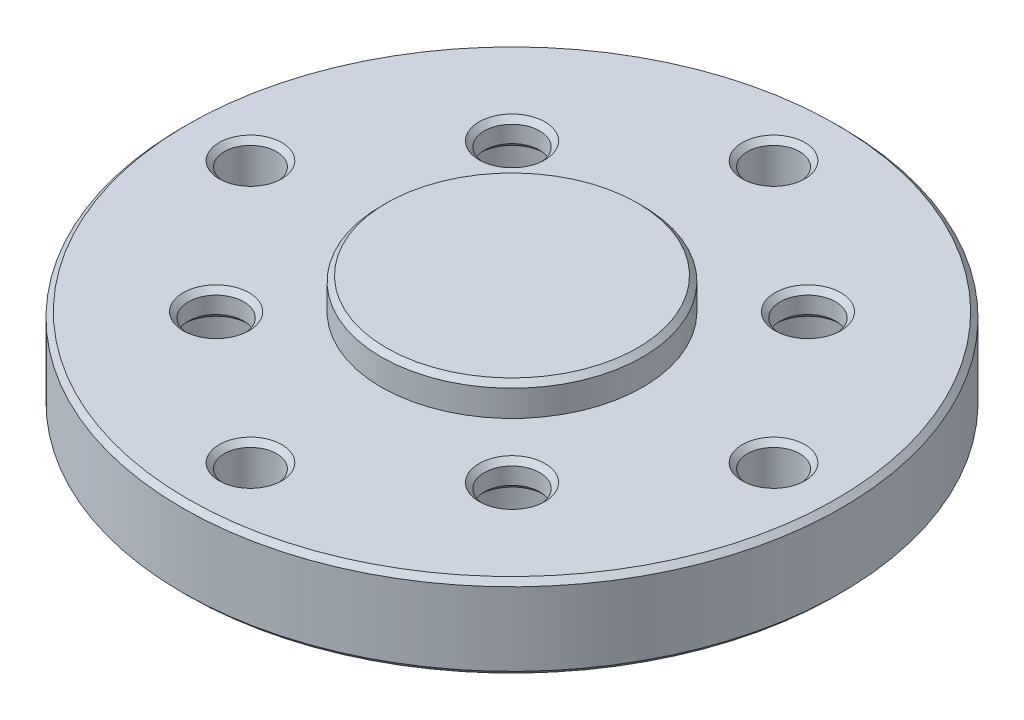
from build123d import *

# Parameters (mm, degrees)
SKETCH1_R                                           = 31.5
BOSS_EXTRUDE1_DEPTH                                 = 8
SKETCH30_R                                          = 12.5
BOSS_EXTRUDE3_DEPTH                                 = 3
TAP_DRILL_FOR_M6_TAP3_D                             = 5
CBORE_FOR_M5_HEX_SOCKET_HEAD_CAP_SCREW1_D           = 5.3
CBORE_FOR_M5_HEX_SOCKET_HEAD_CAP_SCREW1_CBORE_D     = 10
CBORE_FOR_M5_HEX_SOCKET_HEAD_CAP_SCREW1_CBORE_DEPTH = 5.4
CHAMFER1_SIZE                                       = 0.5


with BuildPart() as part:
    # Sketch1 → Boss-Extrude1 (new body)
    with BuildSketch(Plane(origin=(0, 0, 0), x_dir=(1, 0, 0), z_dir=(0, 1, 0))):
        with Locations(Location((0, 0, 0), (0, 0, 270))):
            Circle(SKETCH1_R)
    extrude(amount=BOSS_EXTRUDE1_DEPTH)

    # Sketch30 → Boss-Extrude3 (add)
    with BuildSketch(Plane(origin=(0, 8, 0), x_dir=(1, 0, 0), z_dir=(0, 1, 0))):
        with Locations(Location((0, 0, 0), (0, 0, 270))):
            Circle(SKETCH30_R)
    extrude(amount=BOSS_EXTRUDE3_DEPTH)

    # Tap Drill for M6 Tap3 (through all)
    with Locations(Plane(origin=(0, 8, 0), x_dir=(1, 0, 0), z_dir=(0, 1, 0))):
        with Locations((0, -25), (-25, 0), (0, 25), (25, 0)):
            Hole(TAP_DRILL_FOR_M6_TAP3_D / 2)

    # CBORE for M5 Hex Socket Head Cap Screw1 (through all)
    with Locations(Plane(origin=(0, 0, 0), x_dir=(-1, 0, 0), z_dir=(0, -1, 0))):
        with Locations((-14.142135624, 14.142135624), (14.142135624, 14.142135624), (14.142135624, -14.142135624), (-14.142135624, -14.142135624)):
            CounterBoreHole(CBORE_FOR_M5_HEX_SOCKET_HEAD_CAP_SCREW1_D / 2, CBORE_FOR_M5_HEX_SOCKET_HEAD_CAP_SCREW1_CBORE_D / 2, CBORE_FOR_M5_HEX_SOCKET_HEAD_CAP_SCREW1_CBORE_DEPTH)

    # Chamfer1
    chamfer1_edges = [part.edges().sort_by_distance(p)[0] for p in [
        (2.5, 8, 25),
        (2.5, 0, 25),
        (0, 0, -31.5),
        (27.5, 8, 0),
        (27.5, 0, 0),
        (2.5, 8, -25),
        (2.5, 0, -25),
        (-22.5, 8, 0),
        (-22.5, 0, 0),
        (0, 8, -31.5),
        (19.142135624, 0, 14.142135624),
        (11.492135624, 8, 14.142135624),
        (11.492135624, 5.4, 14.142135624),
        (-9.142135624, 0, 14.142135624),
        (-16.792135624, 8, 14.142135624),
        (-16.792135624, 5.4, 14.142135624),
        (-9.142135624, 0, -14.142135624),
        (-16.792135624, 8, -14.142135624),
        (-16.792135624, 5.4, -14.142135624),
        (19.142135624, 0, -14.142135624),
        (11.492135624, 8, -14.142135624),
        (11.492135624, 5.4, -14.142135624),
        (0, 11, -12.5),
    ]]
    chamfer(chamfer1_edges, length=CHAMFER1_SIZE)


solid = part.part
